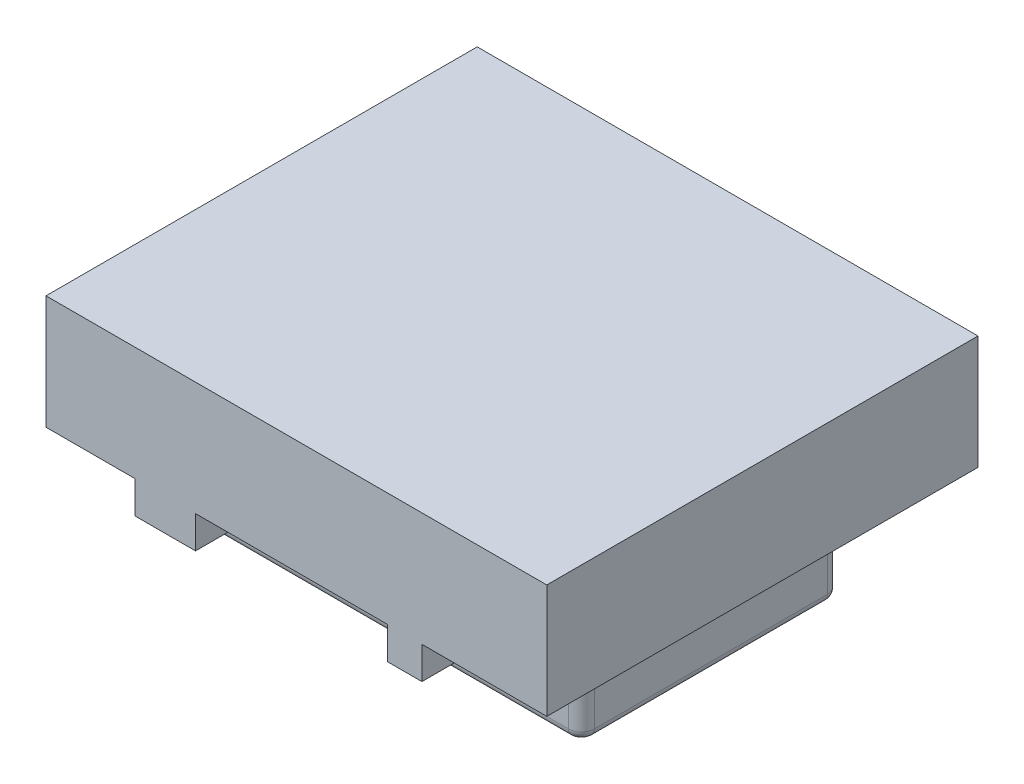
from build123d import *

# Parameters (mm, degrees)
BOTTOM_DEPTH                                         = 2.5
WALLS_DEPTH                                          = 29
SKETCH3_R                                            = 5
BOLTS_DEPTH                                          = 29
TOPCOVER_START                                       = 26.6
TOPCOVER_DEPTH                                       = 2.4
CSK_FOR_M2_5_COUNTERSUNK_FLAT_HEAD_SCREW_D           = 3.1
CSK_FOR_M2_5_COUNTERSUNK_FLAT_HEAD_SCREW_DEPTH       = 22
CSK_FOR_M2_5_COUNTERSUNK_FLAT_HEAD_SCREW_CSINK_D     = 5.5
CSK_FOR_M2_5_COUNTERSUNK_FLAT_HEAD_SCREW_CSINK_ANGLE = 90
CSK_FOR_M2_5_COUNTERSUNK_FLAT_HEAD_SCREW_TIP         = 0.931333959
AC_IN_REACH                                          = 106.676
SKETCH6_W                                            = 24
SKETCH6_H                                            = 18
CONTROL_REACH                                        = 84.128
SKETCH7_R                                            = 7
SKETCH7_R_2                                          = 4
SKETCH7_R_3                                          = 1.75
SKETCH7_W                                            = 24
SKETCH7_H                                            = 15
FILLET1_R                                            = 2
SKETCH8_W                                            = 116.128476494
SKETCH8_H                                            = 26.397161715
CUT1_DEPTH                                           = 50
SKETCH9_W                                            = 14
SKETCH9_H                                            = 29.14122115
CUT2_DEPTH                                           = 50
SKETCH10_W                                           = 8
SKETCH10_H                                           = 22.262234641
CUT3_DEPTH                                           = 50
FILLET2_R                                            = 3


with BuildPart() as part:
    # Sketch1 → Bottom (new body)
    with BuildSketch(Plane(origin=(0, 0, 0), x_dir=(1, 0, 0), z_dir=(0, 1, 0))):
        with BuildLine():
            Line((-45, 30), (45, 30))
            ThreePointArc((45, 30), (47.121320344, 29.121320344), (48, 27))
            Line((48, 27), (48, -27))
            ThreePointArc((48, -27), (47.121320344, -29.121320344), (45, -30))
            Line((45, -30), (-45, -30))
            ThreePointArc((-45, -30), (-47.121320344, -29.121320344), (-48, -27))
            Line((-48, -27), (-48, 27))
            ThreePointArc((-48, 27), (-47.121320344, 29.121320344), (-45, 30))
        make_face()
    extrude(amount=BOTTOM_DEPTH)

    # Sketch1<2> → Walls (add)
    with BuildSketch(Plane(origin=(0, 0, 0), x_dir=(1, 0, 0), z_dir=(0, 1, 0))):
        with BuildLine():
            Line((-45, 30), (45, 30))
            ThreePointArc((45, 30), (47.121320344, 29.121320344), (48, 27))
            Line((48, 27), (48, -27))
            ThreePointArc((48, -27), (47.121320344, -29.121320344), (45, -30))
            Line((45, -30), (-45, -30))
            ThreePointArc((-45, -30), (-47.121320344, -29.121320344), (-48, -27))
            Line((-48, -27), (-48, 27))
            ThreePointArc((-48, 27), (-47.121320344, 29.121320344), (-45, 30))
        make_face()
        with BuildLine():
            Line((-45, 27.6), (45, 27.6))
            ThreePointArc((45, 27.6), (45.424264069, 27.424264069), (45.6, 27))
            Line((45.6, 27), (45.6, -27))
            ThreePointArc((45.6, -27), (45.424264069, -27.424264069), (45, -27.6))
            Line((45, -27.6), (-45, -27.6))
            ThreePointArc((-45, -27.6), (-45.424264069, -27.424264069), (-45.6, -27))
            Line((-45.6, -27), (-45.6, 27))
            ThreePointArc((-45.6, 27), (-45.424264069, 27.424264069), (-45, 27.6))
        make_face(mode=Mode.SUBTRACT)
    extrude(amount=WALLS_DEPTH)

    # Sketch3 → Bolts (add)
    with BuildSketch(Plane(origin=(0, 0, 0), x_dir=(1, 0, 0), z_dir=(0, 1, 0))):
        with Locations((-42, -15.4)):
            Circle(SKETCH3_R)
        with Locations((42, -15.4)):
            Circle(SKETCH3_R)
    extrude(amount=BOLTS_DEPTH)

    # Sketch1<3> → TopCover (add)
    with BuildSketch(Plane(origin=(0, 0, 0), x_dir=(1, 0, 0), z_dir=(0, 1, 0)).offset(TOPCOVER_START)):
        with BuildLine():
            Line((-45, 30), (45, 30))
            ThreePointArc((45, 30), (47.121320344, 29.121320344), (48, 27))
            Line((48, 27), (48, -27))
            ThreePointArc((48, -27), (47.121320344, -29.121320344), (45, -30))
            Line((45, -30), (-45, -30))
            ThreePointArc((-45, -30), (-47.121320344, -29.121320344), (-48, -27))
            Line((-48, -27), (-48, 27))
            ThreePointArc((-48, 27), (-47.121320344, 29.121320344), (-45, 30))
        make_face()
    extrude(amount=TOPCOVER_DEPTH)

    # CSK for M2.5 Countersunk Flat Head Screw1
    with Locations(Plane(origin=(0, 29, 0), x_dir=(1, 0, 0), z_dir=(0, 1, 0))):
        with Locations((-42, -15.4), (42, -15.4)):
            CounterSinkHole(CSK_FOR_M2_5_COUNTERSUNK_FLAT_HEAD_SCREW_D / 2, CSK_FOR_M2_5_COUNTERSUNK_FLAT_HEAD_SCREW_CSINK_D / 2, depth=CSK_FOR_M2_5_COUNTERSUNK_FLAT_HEAD_SCREW_DEPTH, counter_sink_angle=CSK_FOR_M2_5_COUNTERSUNK_FLAT_HEAD_SCREW_CSINK_ANGLE)
            with Locations((0, 0, -(CSK_FOR_M2_5_COUNTERSUNK_FLAT_HEAD_SCREW_DEPTH + CSK_FOR_M2_5_COUNTERSUNK_FLAT_HEAD_SCREW_TIP / 2))):  # 118° drill point
                Cone(0, CSK_FOR_M2_5_COUNTERSUNK_FLAT_HEAD_SCREW_D / 2, CSK_FOR_M2_5_COUNTERSUNK_FLAT_HEAD_SCREW_TIP, mode=Mode.SUBTRACT)

    # Sketch6 → AC_In (cut, up to next)
    with BuildSketch(Plane.ZY.offset(48), mode=Mode.PRIVATE) as ac_in_sk1:
        with Locations((-6.838985664, 15)):
            Rectangle(SKETCH6_W, SKETCH6_H)
    ac_in_tool1 = extrude(ac_in_sk1.sketch, amount=-AC_IN_REACH, mode=Mode.PRIVATE) & part.part
    add(ac_in_tool1.solids().sort_by_distance((-48, 15, -6.838986))[0], mode=Mode.SUBTRACT)

    # Sketch7 → Control (cut, up to next)
    with BuildSketch(Plane.XY.offset(30), mode=Mode.PRIVATE) as control_sk1:
        with Locations((-28.5, 14.5)):
            Circle(SKETCH7_R)
    control_tool1 = extrude(control_sk1.sketch, amount=-CONTROL_REACH, mode=Mode.PRIVATE) & part.part
    # Sketch7 → Control (cut, up to next)
    with BuildSketch(Plane.XY.offset(30), mode=Mode.PRIVATE) as control_sk2:
        with Locations((27, 14.5)):
            Circle(SKETCH7_R_2)
    control_tool2 = extrude(control_sk2.sketch, amount=-CONTROL_REACH, mode=Mode.PRIVATE) & part.part
    # Sketch7 → Control (cut, up to next)
    with BuildSketch(Plane.XY.offset(30), mode=Mode.PRIVATE) as control_sk3:
        with Locations((-16.5, 14.5)):
            Circle(SKETCH7_R_3)
    control_tool3 = extrude(control_sk3.sketch, amount=-CONTROL_REACH, mode=Mode.PRIVATE) & part.part
    # Sketch7 → Control (cut, up to next)
    with BuildSketch(Plane.XY.offset(30), mode=Mode.PRIVATE) as control_sk4:
        with Locations((-16.5, 7.2)):
            Circle(SKETCH7_R_3)
    control_tool4 = extrude(control_sk4.sketch, amount=-CONTROL_REACH, mode=Mode.PRIVATE) & part.part
    # Sketch7 → Control (cut, up to next)
    with BuildSketch(Plane.XY.offset(30), mode=Mode.PRIVATE) as control_sk5:
        with Locations((0, 14.5)):
            Rectangle(SKETCH7_W, SKETCH7_H)
    control_tool5 = extrude(control_sk5.sketch, amount=-CONTROL_REACH, mode=Mode.PRIVATE) & part.part
    add(control_tool1.solids().sort_by_distance((-28.5, 14.5, 30))[0], mode=Mode.SUBTRACT)
    add(control_tool2.solids().sort_by_distance((27, 14.5, 30))[0], mode=Mode.SUBTRACT)
    add(control_tool3.solids().sort_by_distance((-16.5, 14.5, 30))[0], mode=Mode.SUBTRACT)
    add(control_tool4.solids().sort_by_distance((-16.5, 7.2, 30))[0], mode=Mode.SUBTRACT)
    add(control_tool5.solids().sort_by_distance((0, 14.5, 30))[0], mode=Mode.SUBTRACT)

    # Fillet1
    fillet1_edges = [part.edges().sort_by_distance(p)[0] for p in [
        (0, 0, 30),
        (-47.121320344, 0, 29.121320344),
        (-47.121320344, 29, 29.121320344),
        (0, 29, 30),
        (47.121320344, 29, 29.121320344),
        (48, 29, 0),
        (47.121320344, 29, -29.121320344),
        (0, 29, -30),
        (-47.121320344, 29, -29.121320344),
        (-48, 29, 0),
        (-48, 0, 0),
        (-47.121320344, 0, -29.121320344),
        (0, 0, -30),
        (47.121320344, 0, -29.121320344),
        (48, 0, 0),
        (47.121320344, 0, 29.121320344),
    ]]
    fillet(fillet1_edges, radius=FILLET1_R)

    # Fillet2
    fillet2_edges = [part.edges().sort_by_distance(p)[0] for p in [
        (45.6, 14.55, 18.869870315),
        (-45.6, 14.55, 11.930129685),
        (-45.6, 14.55, 18.869870315),
        (45.6, 14.55, 11.930129685),
    ]]
    fillet(fillet2_edges, radius=FILLET2_R)


with BuildPart() as body_2:
    # Sketch8 → Cut1 (new, symmetric)
    with BuildSketch(Plane.XY):
        with Locations((1.891186967, 35.198580858)):
            Rectangle(SKETCH8_W, SKETCH8_H)
    extrude(amount=CUT1_DEPTH, both=True)

    # Sketch9 → Cut2 (add)
    with BuildSketch(Plane.XY):
        with Locations((-28.5, 29.070610575)):
            Rectangle(SKETCH9_W, SKETCH9_H)
    extrude(amount=CUT2_DEPTH)

    # Sketch10 → Cut3 (add)
    with BuildSketch(Plane.XY):
        with Locations((27, 25.63111732)):
            Rectangle(SKETCH10_W, SKETCH10_H)
    extrude(amount=CUT3_DEPTH)


solid = Compound([part.part, body_2.part])
